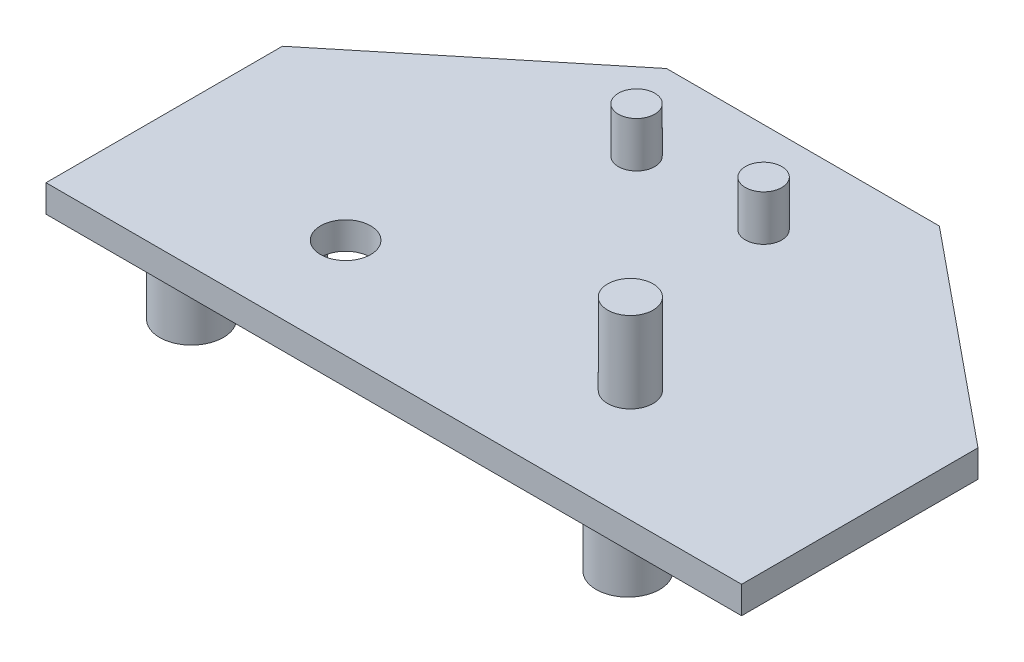
from build123d import *

# Parameters (mm, degrees)
SKETCH1_R             = 3.5
SKETCH1_R_2           = 1.5
BOSS_EXTRUDE1_DEPTH   = 10
BOSS_EXTRUDE1_2_DEPTH = 10
BOSS_EXTRUDE1_3_DEPTH = 10
BOSS_EXTRUDE1_4_DEPTH = 10
BOSS_EXTRUDE2_DEPTH   = 3
SKETCH3_R             = 2.75
CUT_EXTRUDE1_DEPTH    = 4
SKETCH4_R             = 2.5
BOSS_EXTRUDE3_DEPTH   = 8.9
SKETCH5_R             = 2
BOSS_EXTRUDE4_DEPTH   = 5


with BuildPart() as part:
    # Sketch1 → Boss-Extrude1 (new body)
    with BuildSketch(Plane(origin=(0, 0, 0), x_dir=(1, 0, 0), z_dir=(0, 1, 0))):
        with Locations(Location((0, 0, 0), (0, 0, 270))):
            Circle(SKETCH1_R)
        with Locations(Location((0, 0, 0), (0, 0, 270))):
            Circle(SKETCH1_R_2, mode=Mode.SUBTRACT)
    extrude(amount=BOSS_EXTRUDE1_DEPTH)



with BuildPart() as body_2:
    # Sketch1 → Boss-Extrude1 2 (new body)
    with BuildSketch(Plane(origin=(0, 0, 0), x_dir=(1, 0, 0), z_dir=(0, 1, 0))):
        with Locations(Location((0, -10, 0), (0, 0, 270))):
            Circle(SKETCH1_R)
        with Locations(Location((0, -10, 0), (0, 0, 270))):
            Circle(SKETCH1_R_2, mode=Mode.SUBTRACT)
    extrude(amount=BOSS_EXTRUDE1_2_DEPTH)


with BuildPart() as body_3:
    # Sketch1 → Boss-Extrude1 3 (new body)
    with BuildSketch(Plane(origin=(0, 0, 0), x_dir=(1, 0, 0), z_dir=(0, 1, 0))):
        with Locations(Location((48, -10, 0), (0, 0, 270))):
            Circle(SKETCH1_R)
        with Locations(Location((48, -10, 0), (0, 0, 270))):
            Circle(SKETCH1_R_2, mode=Mode.SUBTRACT)
    extrude(amount=BOSS_EXTRUDE1_3_DEPTH)


with BuildPart() as body_4:
    # Sketch1 → Boss-Extrude1 4 (new body)
    with BuildSketch(Plane(origin=(0, 0, 0), x_dir=(1, 0, 0), z_dir=(0, 1, 0))):
        with Locations(Location((48, 0, 0), (0, 0, 270))):
            Circle(SKETCH1_R)
        with Locations(Location((48, 0, 0), (0, 0, 270))):
            Circle(SKETCH1_R_2, mode=Mode.SUBTRACT)
    extrude(amount=BOSS_EXTRUDE1_4_DEPTH)


with BuildPart() as part_1:
    add(part.part)

    add(body_2.part)  # Boss-Extrude2 merges body 2

    add(body_3.part)  # Boss-Extrude2 merges body 3

    add(body_4.part)  # Boss-Extrude2 merges body 4
    # Sketch2 → Boss-Extrude2 (add)
    with BuildSketch(Plane(origin=(0, 10, 0), x_dir=(1, 0, 0), z_dir=(0, 1, 0))):
        Polygon((-8, -18), (-8, 8), (15.25, 27), (45.25, 27), (68.5, 8), (68.5, -18), align=None)
    extrude(amount=BOSS_EXTRUDE2_DEPTH)

    # Sketch3 → Cut-Extrude1 (cut)
    with BuildSketch(Plane.XZ.offset(-10)):
        with Locations(Location((13.95, 7, 0), (0, 0, 270))):
            Circle(SKETCH3_R)
    extrude(amount=-CUT_EXTRUDE1_DEPTH, mode=Mode.SUBTRACT)

    # Sketch4 → Boss-Extrude3 (add)
    with BuildSketch(Plane(origin=(0, 13, 0), x_dir=(1, 0, 0), z_dir=(0, 1, 0))):
        with Locations(Location((43.919609607, -5.65, 0), (0, 0, 90))):
            Circle(SKETCH4_R)
    extrude(amount=BOSS_EXTRUDE3_DEPTH)

    # Sketch5 → Boss-Extrude4 (add)
    with BuildSketch(Plane(origin=(0, 13, 0), x_dir=(1, 0, 0), z_dir=(0, 1, 0))):
        with Locations(Location((21.95, 17, 0), (0, 0, 90))):
            Circle(SKETCH5_R)
        with Locations(Location((35.919609607, 17, 0), (0, 0, 90))):
            Circle(SKETCH5_R)
    extrude(amount=BOSS_EXTRUDE4_DEPTH)


solid = part_1.part
